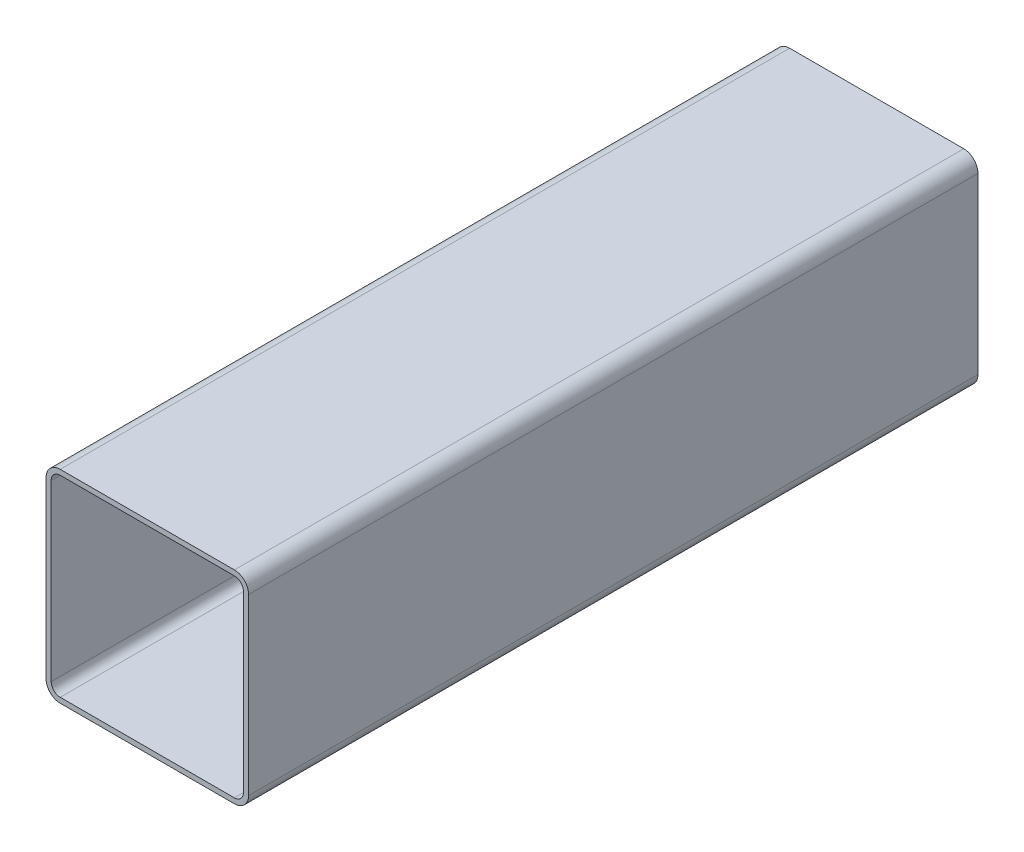
from build123d import *

# Parameters (mm, degrees)
STRUCTURAL_MEMBER1_DEPTH = 304.8


with BuildPart() as part:
    # Sketch137 → Structural Member1 (new body)
    with BuildSketch(Plane(origin=(0, 0, 0), x_dir=(-1, 0, 0), z_dir=(0, 0, -1))):
        with BuildLine():
            Line((-42.3291, 36.3855), (-42.3291, -36.3855))
            ThreePointArc((-42.3291, -36.3855), (-40.588259865, -40.588259865), (-36.3855, -42.3291))
            Line((-36.3855, -42.3291), (36.3855, -42.3291))
            ThreePointArc((36.3855, -42.3291), (40.588259865, -40.588259865), (42.3291, -36.3855))
            Line((42.3291, -36.3855), (42.3291, 36.3855))
            ThreePointArc((42.3291, 36.3855), (40.588259865, 40.588259865), (36.3855, 42.3291))
            Line((36.3855, 42.3291), (-36.3855, 42.3291))
            ThreePointArc((-36.3855, 42.3291), (-40.588259865, 40.588259865), (-42.3291, 36.3855))
        make_face()
        with BuildLine():
            Line((-40.1701, 36.3855), (-40.1701, -36.3855))
            ThreePointArc((-40.1701, -36.3855), (-39.061616324, -39.061616324), (-36.3855, -40.1701))
            Line((-36.3855, -40.1701), (36.3855, -40.1701))
            ThreePointArc((36.3855, -40.1701), (39.061616324, -39.061616324), (40.1701, -36.3855))
            Line((40.1701, -36.3855), (40.1701, 36.3855))
            ThreePointArc((40.1701, 36.3855), (39.061616324, 39.061616324), (36.3855, 40.1701))
            Line((36.3855, 40.1701), (-36.3855, 40.1701))
            ThreePointArc((-36.3855, 40.1701), (-39.061616324, 39.061616324), (-40.1701, 36.3855))
        make_face(mode=Mode.SUBTRACT)
    extrude(amount=STRUCTURAL_MEMBER1_DEPTH)


solid = part.part
